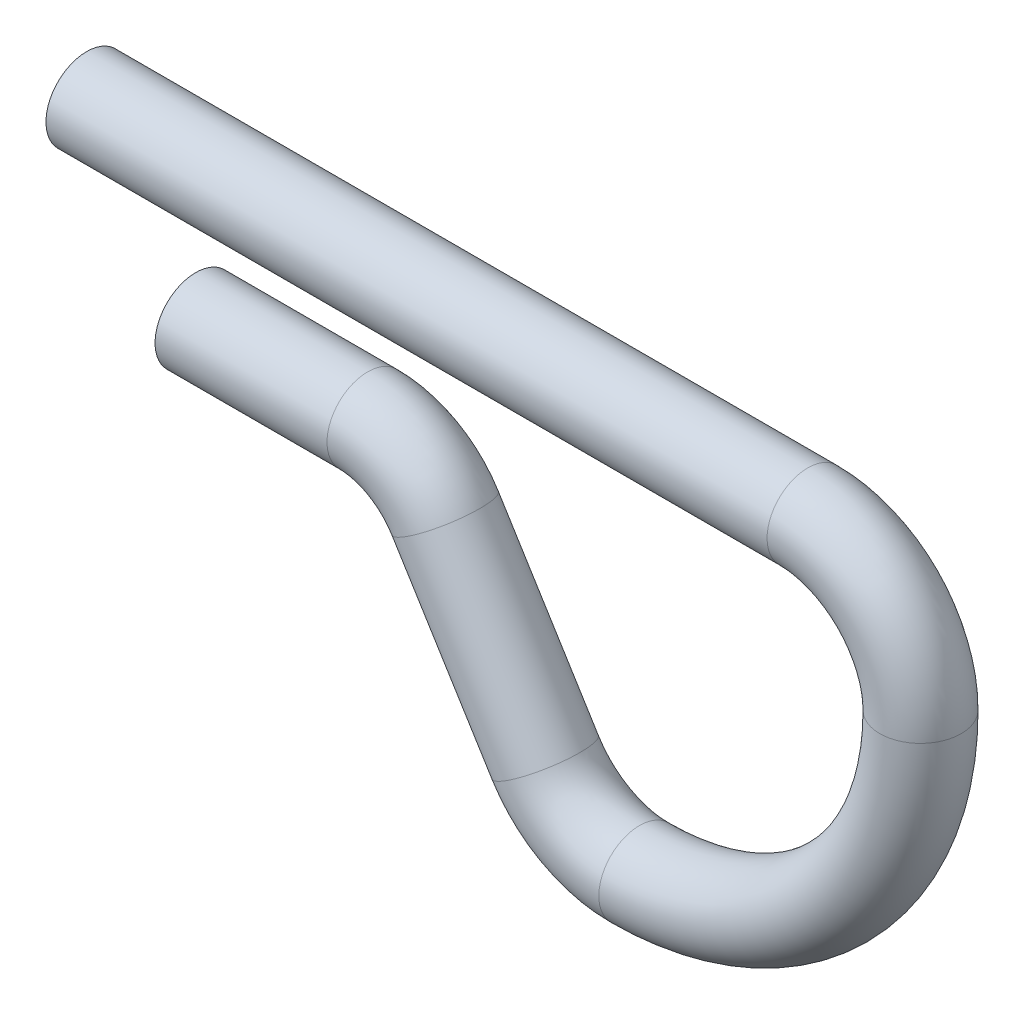
from build123d import *

# Parameters (mm, degrees)
SKETCH3_R = 5.588


with BuildPart() as part:
    # Sweep1: sweep along a path in Sketch2
    with BuildLine(Plane.XY) as sweep1_path:
        Line((-14.986, 18.796), (84.074, 18.796))
        ThreePointArc((84.074, 18.796), (95.029912468, 14.257912468), (99.568, 3.302))
        ThreePointArc((99.568, 3.302), (88.259978608, -23.997978608), (60.96, -35.306))
        ThreePointArc((60.96, -35.306), (53.546892782, -33.381533837), (48.006, -28.09416816))
        Line((48.006, -28.09416816), (34.267947791, -5.92687859))
        ThreePointArc((34.267947791, -5.92687859), (29.714292142, -1.581578377), (23.622, 0))
        Line((23.622, 0), (0, 0))
    # Sketch3 → Sweep1 (sweep)
    with BuildSketch(Plane(origin=(-14.986, 0, 0), x_dir=(0, 0, -1), z_dir=(1, 0, 0))):
        with Locations((0, 18.796)):
            Circle(SKETCH3_R)
    sweep(path=sweep1_path.line)


solid = part.part
